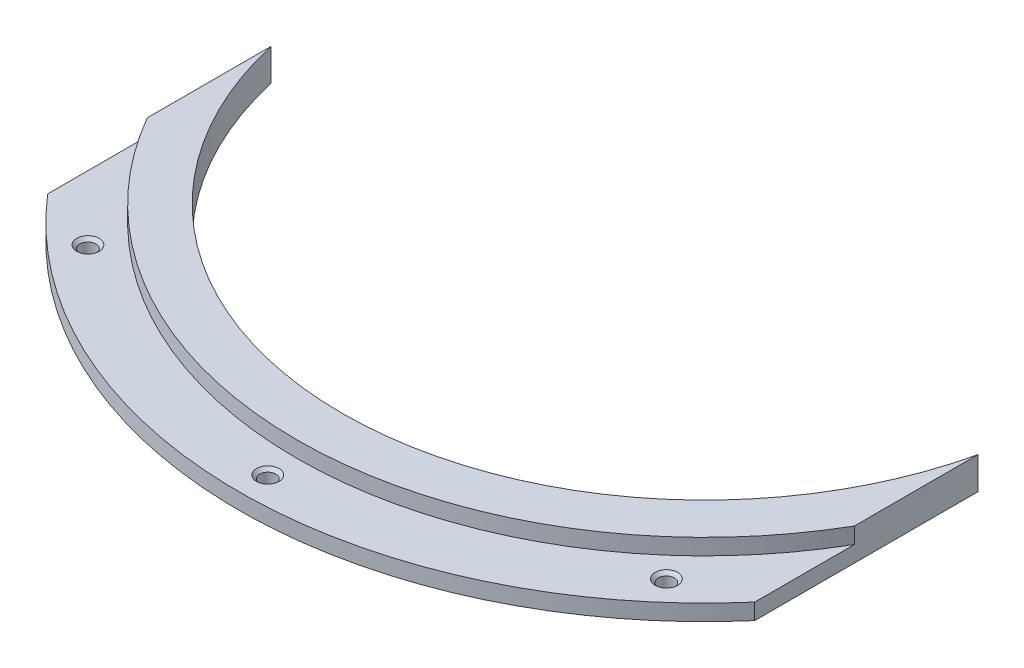
from build123d import *

# Parameters (mm, degrees)
BOSS_EXTRUDE1_DEPTH = 12.7
BOSS_EXTRUDE2_DEPTH = 6.35
SKETCH3_R           = 3.175
CUT_EXTRUDE1_DEPTH  = 12.7
CHAMFER1_SIZE       = 1.27


with BuildPart() as part:
    # Sketch1 → Boss-Extrude1 (new body)
    with BuildSketch(Plane(origin=(0, 0, 0), x_dir=(1, 0, 0), z_dir=(0, 1, 0))):
        with BuildLine():
            Line((279.4, 247.65), (279.4, 198.787506551))
            ThreePointArc((279.4, 198.787506551), (139.7, 118.11), (0, 198.787506551))
            Line((0, 198.787506551), (0, 247.65))
            ThreePointArc((0, 247.65), (139.7, 136.137470007), (279.4, 247.65))
        make_face()
    extrude(amount=BOSS_EXTRUDE1_DEPTH)

    # Sketch2 → Boss-Extrude2 (add)
    with BuildSketch(Plane.XZ):
        with BuildLine():
            Line((0, -198.787506551), (0, -159.420282964))
            ThreePointArc((0, -159.420282964), (139.7, -95.25), (279.4, -159.420282964))
            Line((279.4, -159.420282964), (279.4, -198.787506551))
            ThreePointArc((279.4, -198.787506551), (139.7, -118.11), (0, -198.787506551))
        make_face()
    extrude(amount=-BOSS_EXTRUDE2_DEPTH)

    # Sketch3 → Cut-Extrude1 (cut)
    with BuildSketch(Plane(origin=(0, 6.35, 0), x_dir=(1, 0, 0), z_dir=(0, 1, 0))):
        with Locations(Location((139.7, 106.68, 0), (0, 0, 270))):
            Circle(SKETCH3_R)
        with Locations(Location((25.4, 149.909813499, 0), (0, 0, 270))):
            Circle(SKETCH3_R)
        with Locations(Location((254, 149.909813499, 0), (0, 0, 270))):
            Circle(SKETCH3_R)
    extrude(amount=-CUT_EXTRUDE1_DEPTH, mode=Mode.SUBTRACT)

    # Chamfer1
    chamfer1_edges = [part.edges().sort_by_distance(p)[0] for p in [
        (139.7, 6.35, -109.855),
        (25.4, 6.35, -153.084813499),
        (254, 6.35, -153.084813499),
    ]]
    chamfer(chamfer1_edges, length=CHAMFER1_SIZE)


solid = part.part
